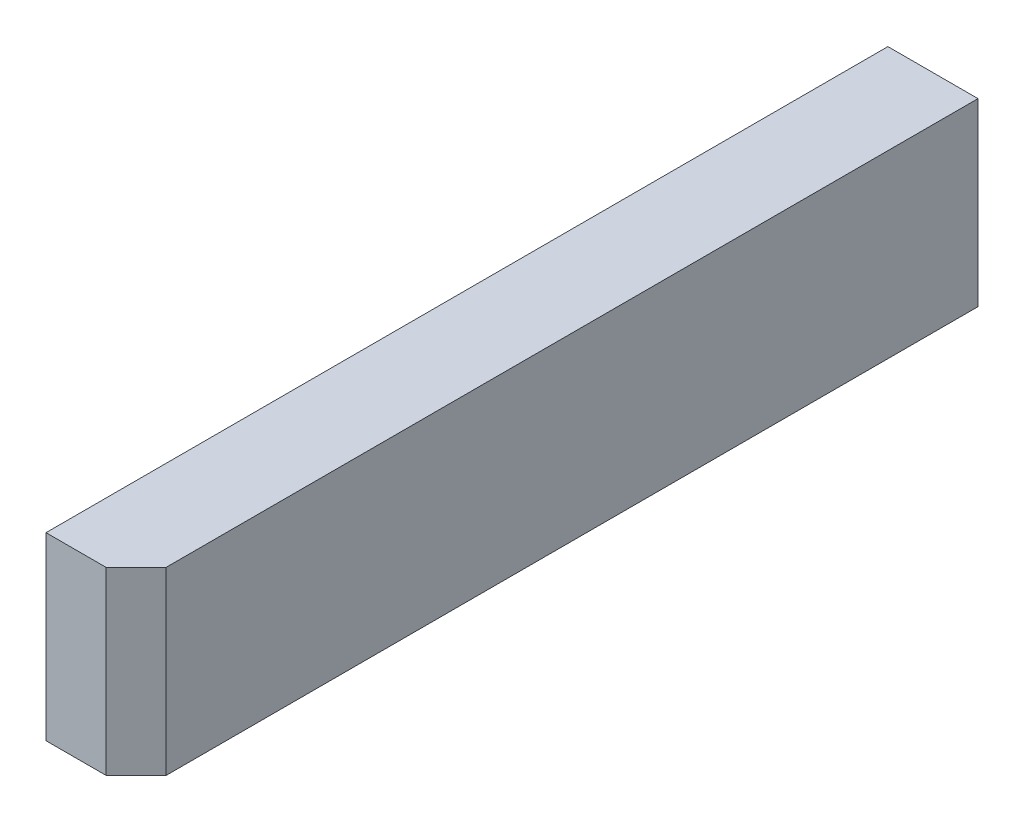
from build123d import *

# Parameters (mm, degrees)
SKETCH1_W           = 178
SKETCH1_H           = 38.1
BOSS_EXTRUDE1_DEPTH = 19.05
CHAMFER1_SIZE       = 6.35


with BuildPart() as part:
    # Sketch1 → Boss-Extrude1 (new body)
    with BuildSketch(Plane(origin=(0, 0, 0), x_dir=(0, 0, -1), z_dir=(1, 0, 0))):
        Rectangle(SKETCH1_W, SKETCH1_H)
    extrude(amount=BOSS_EXTRUDE1_DEPTH)

    # Chamfer1
    chamfer1_edges = [part.edges().sort_by_distance(p)[0] for p in [
        (19.05, 0, 89),
    ]]
    chamfer(chamfer1_edges, length=CHAMFER1_SIZE)


solid = part.part
